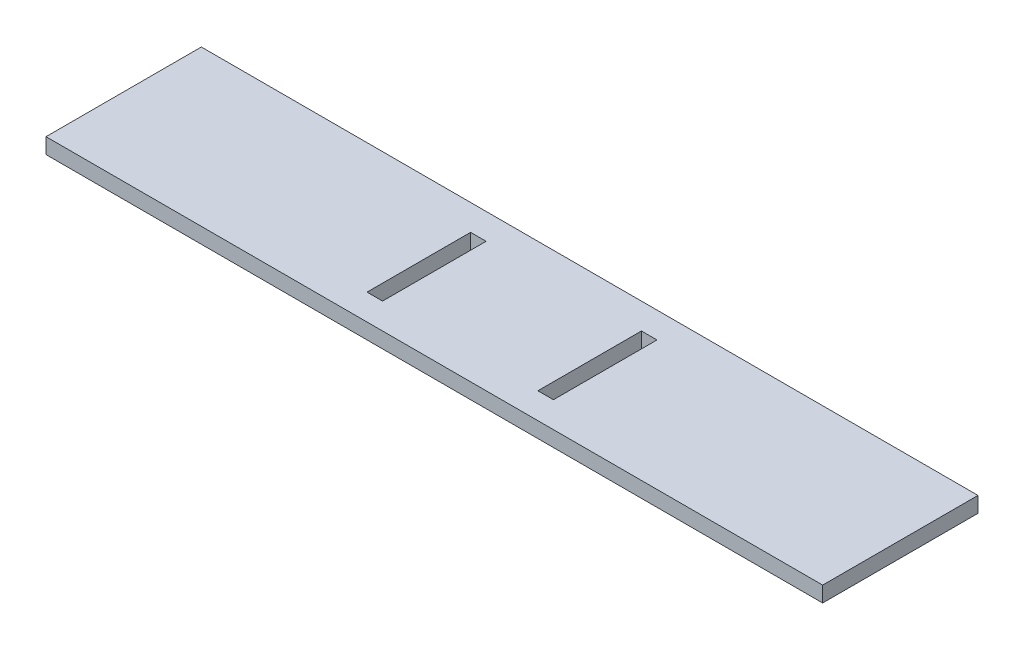
from build123d import *

# Parameters (mm, degrees)
ESBO_O1_W                = 150
ESBO_O1_H                = 30
ESBO_O1_W_2              = 3
ESBO_O1_H_2              = 20
RESSALTO_EXTRUS_O1_DEPTH = 3


with BuildPart() as part:
    # Esboço1 → Ressalto-extrusão1 (new body)
    with BuildSketch(Plane(origin=(0, 0, 0), x_dir=(1, 0, 0), z_dir=(0, 1, 0))):
        with Locations((75, 15)):
            Rectangle(ESBO_O1_W, ESBO_O1_H)
        with Locations((91.5, 15)):
            Rectangle(ESBO_O1_W_2, ESBO_O1_H_2, mode=Mode.SUBTRACT)
        with Locations((58.5, 15)):
            Rectangle(ESBO_O1_W_2, ESBO_O1_H_2, mode=Mode.SUBTRACT)
    extrude(amount=RESSALTO_EXTRUS_O1_DEPTH)


solid = part.part
